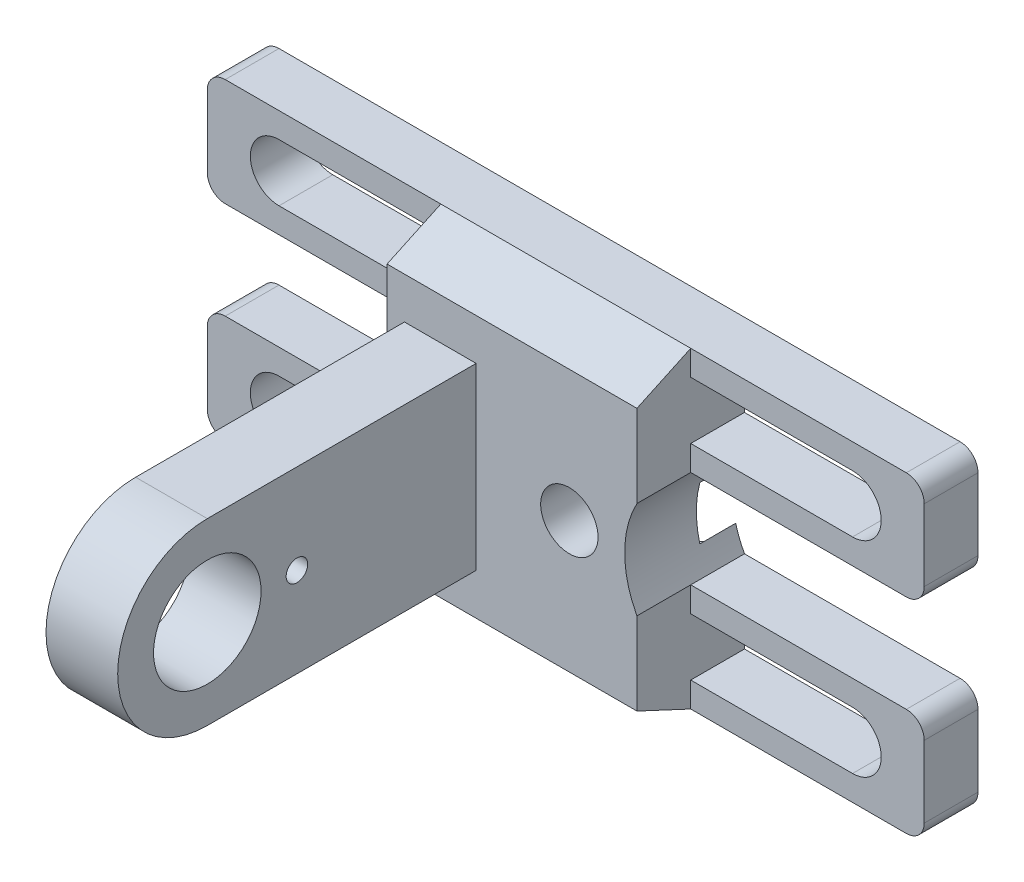
from build123d import *

# Parameters (mm, degrees)
EXTRUDE_1_DEPTH     = 3
EXTRUDE_START       = -3
EXTRUDE_2_DEPTH     = 6
EXTRUDE_START_2     = -2
SKETCH_3_R          = 3
SKETCH_3_R_2        = 0.6
EXTRUDE_3_DEPTH     = 4
FILLET_2_R          = 1
EXTRUDE_4_DEPTH     = 13.942167231
SKETCH_8_R          = 1.6
CUT_EXTRUDE_1_DEPTH = 30.596473185
SKETCH_9_R          = 3.6
CUT_EXTRUDE_2_DEPTH = 2


with BuildPart() as part:
    # 草图1 → 凸台-拉伸1 (new body)
    with BuildSketch(Plane.XY):
        with BuildLine():
            Line((20, 8.715), (20, 2.715))
            Line((20, 2.715), (6.971083616, 2.715))
            ThreePointArc((6.971083616, 2.715), (6.285, 0), (6.971083616, -2.715))
            Line((6.971083616, -2.715), (20, -2.715))
            Line((20, -2.715), (20, -8.715))
            Line((20, -8.715), (-20, -8.715))
            Line((-20, -8.715), (-20, -2.715))
            Line((-20, -2.715), (-6.971083616, -2.715))
            ThreePointArc((-6.971083616, -2.715), (-6.285, 0), (-6.971083616, 2.715))
            Line((-6.971083616, 2.715), (-20, 2.715))
            Line((-20, 2.715), (-20, 8.715))
            Line((-20, 8.715), (20, 8.715))
        make_face()
        with BuildLine():
            Line((16, 4.115), (-16, 4.115))
            ThreePointArc((-16, 4.115), (-17.6, 5.715), (-16, 7.315))
            Line((-16, 7.315), (16, 7.315))
            ThreePointArc((16, 7.315), (17.6, 5.715), (16, 4.115))
        make_face(mode=Mode.SUBTRACT)
        with BuildLine():
            Line((16, -7.315), (-16, -7.315))
            ThreePointArc((-16, -7.315), (-17.6, -5.715), (-16, -4.115))
            Line((-16, -4.115), (16, -4.115))
            ThreePointArc((16, -4.115), (17.6, -5.715), (16, -7.315))
        make_face(mode=Mode.SUBTRACT)
    extrude(amount=EXTRUDE_1_DEPTH)

    # 草图2 → 凸台-拉伸2 (add)
    with BuildSketch(Plane.XY.offset(3).offset(EXTRUDE_START)):
        with BuildLine():
            Line((-6.971083616, 2.715), (-6.971083616, 4.115))
            Line((-6.971083616, 4.115), (-6.971083616, 7.315))
            Line((-6.971083616, 7.315), (6.971083616, 7.315))
            Line((6.971083616, 7.315), (6.971083616, 4.115))
            Line((6.971083616, 4.115), (6.971083616, 2.715))
            ThreePointArc((6.971083616, 2.715), (6.285, 0), (6.971083616, -2.715))
            Line((6.971083616, -2.715), (6.971083616, -4.115))
            Line((6.971083616, -4.115), (6.971083616, -7.315))
            Line((6.971083616, -7.315), (-6.971083616, -7.315))
            Line((-6.971083616, -7.315), (-6.971083616, -4.115))
            Line((-6.971083616, -4.115), (-6.971083616, -2.715))
            ThreePointArc((-6.971083616, -2.715), (-6.285, 0), (-6.971083616, 2.715))
        make_face()
    extrude(amount=EXTRUDE_2_DEPTH)

    # 草图3 → 凸台-拉伸3 (add)
    with BuildSketch(Plane(origin=(0, 0, 0), x_dir=(0, 0, -1), z_dir=(1, 0, 0)).offset(EXTRUDE_START_2)):
        with BuildLine():
            Line((-6, 5), (-21, 5))
            ThreePointArc((-21, 5), (-26, 0), (-21, -5))
            Line((-21, -5), (-6, -5))
            Line((-6, -5), (-6, 5))
        make_face()
        with Locations((-21, 0)):
            Circle(SKETCH_3_R, mode=Mode.SUBTRACT)
        with Locations((-16, 0)):
            Circle(SKETCH_3_R_2, mode=Mode.SUBTRACT)
    extrude(amount=-EXTRUDE_3_DEPTH)

    # 圆角2
    fillet_2_edges = [part.edges().sort_by_distance(p)[0] for p in [
        (-20, -8.715, 1.5),
        (-20, -2.715, 1.5),
        (-20, 2.715, 1.5),
        (-20, 8.715, 1.5),
        (20, 8.715, 1.5),
        (20, 2.715, 1.5),
        (20, -2.715, 1.5),
        (20, -8.715, 1.5),
    ]]
    fillet(fillet_2_edges, radius=FILLET_2_R)

    # 草图6 → 凸台-拉伸4 (add)
    with BuildSketch(Plane(origin=(6.971083616, 0, 0), x_dir=(0, 0, -1), z_dir=(1, 0, 0))):
        Polygon((-6, 7.315), (-3, 8.715), (-3, 7.315), align=None)
        Polygon((-3, -7.315), (-6, -7.315), (-3, -8.715), align=None)
    extrude(amount=-EXTRUDE_4_DEPTH)

    # 草图8 → 切除-拉伸1 (cut, through all)
    with BuildSketch(Plane.XY.offset(6)):
        with Locations((3.2, 0)):
            Circle(SKETCH_8_R)
    extrude(amount=-CUT_EXTRUDE_1_DEPTH, mode=Mode.SUBTRACT)

    # 草图9 → 切除-拉伸2 (cut)
    with BuildSketch(Plane(origin=(0, 0, 0), x_dir=(-1, 0, 0), z_dir=(0, 0, -1))):
        with Locations((-3.2, 0)):
            Circle(SKETCH_9_R)
    extrude(amount=-CUT_EXTRUDE_2_DEPTH, mode=Mode.SUBTRACT)


solid = part.part
